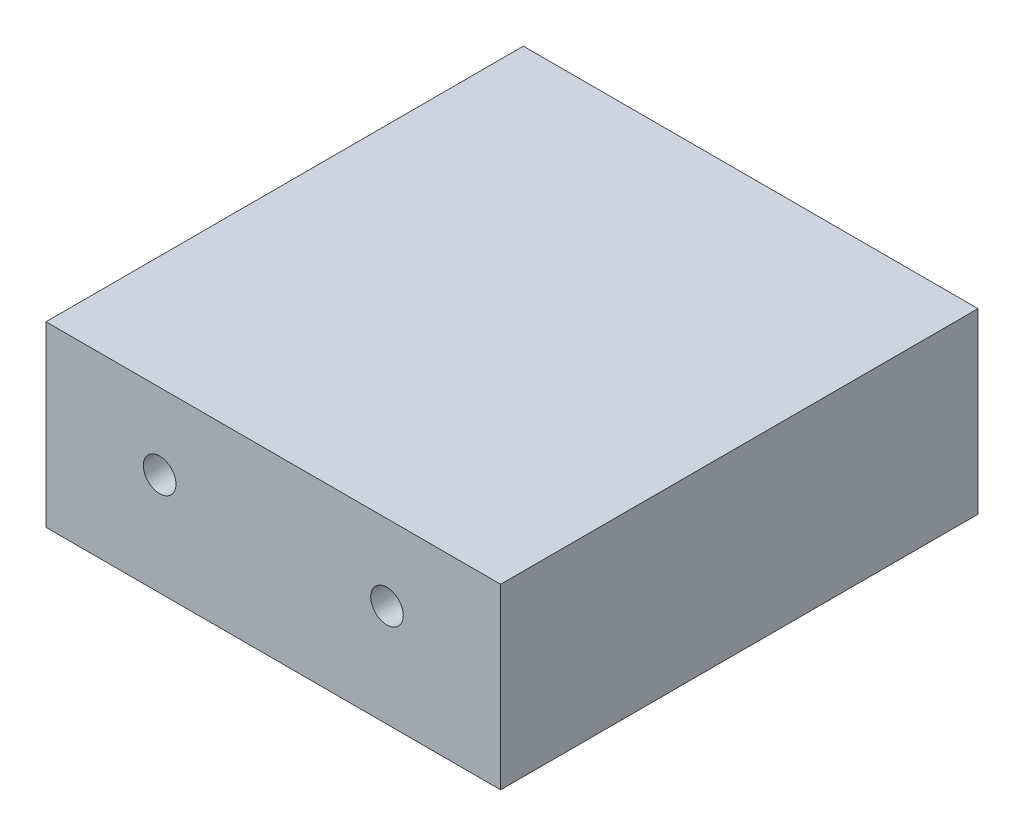
from build123d import *

# Parameters (mm, degrees)
SK_TOP_W             = 60
SK_TOP_H             = 63
EX_TOP_DEPTH         = 23.5
SK_RAILBOLTS_R       = 2.15
CUT_RAILBOLTS_DEPTH  = 8
SK_INSERTS_M4_R      = 2.8
CUT_INSERTS_M4_DEPTH = 8.1


with BuildPart() as part:
    # SK_Top → EX_Top (new body)
    with BuildSketch(Plane(origin=(0, 0, 0), x_dir=(1, 0, 0), z_dir=(0, 1, 0))):
        with Locations((0, -6.5)):
            Rectangle(SK_TOP_W, SK_TOP_H)
    extrude(amount=EX_TOP_DEPTH)

    # SK_RailBolts → CUT_RailBolts (cut)
    with BuildSketch(Plane.XY.offset(38)):
        with Locations((15, 13.5)):
            Circle(SK_RAILBOLTS_R)
        with Locations((-15, 13.5)):
            Circle(SK_RAILBOLTS_R)
    extrude(amount=-CUT_RAILBOLTS_DEPTH, mode=Mode.SUBTRACT)

    # SK_Inserts_M4 → CUT_Inserts_M4 (cut)
    with BuildSketch(Plane(origin=(0, 0, 0), x_dir=(1, 0, 0), z_dir=(0, 1, 0))):
        with Locations((15, -15)):
            Circle(SK_INSERTS_M4_R)
        with Locations((-15, -15)):
            Circle(SK_INSERTS_M4_R)
        with Locations((15, 15)):
            Circle(SK_INSERTS_M4_R)
        with Locations((-15, 15)):
            Circle(SK_INSERTS_M4_R)
    extrude(amount=CUT_INSERTS_M4_DEPTH, mode=Mode.SUBTRACT)


solid = part.part
